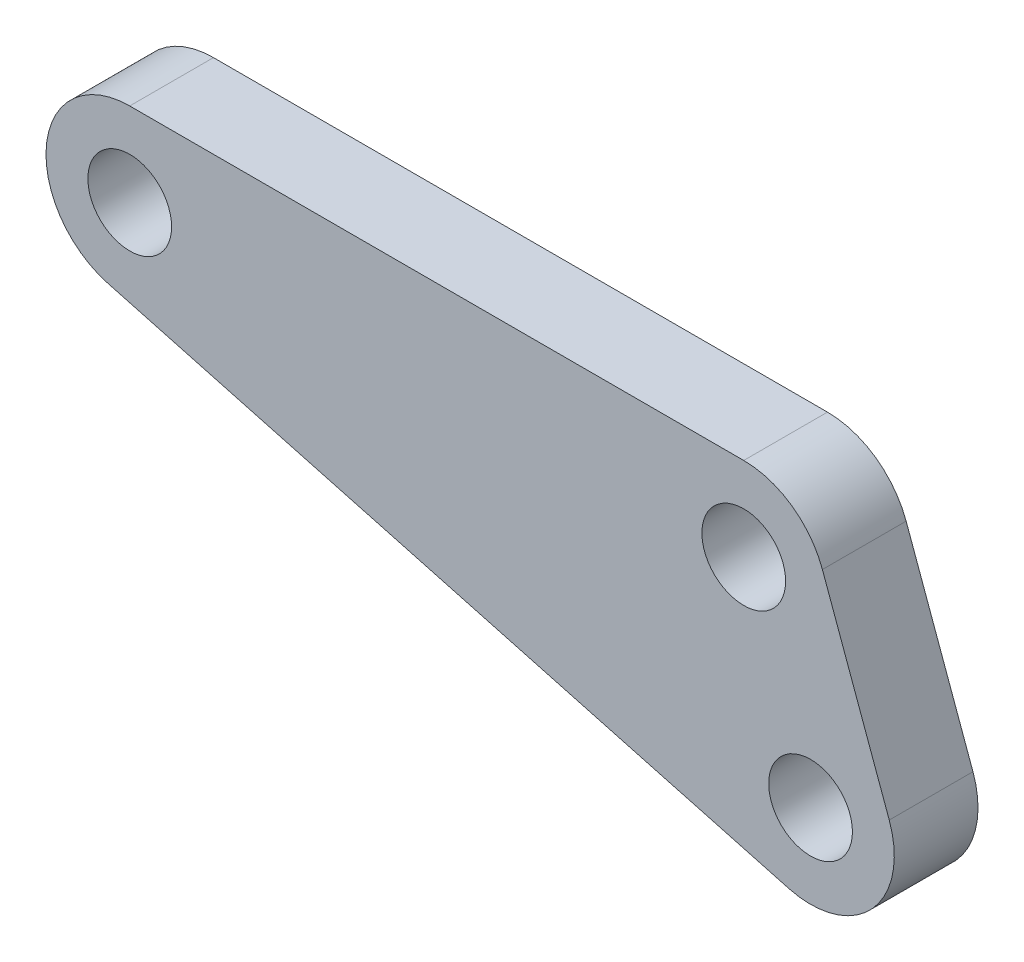
from build123d import *

# Parameters (mm, degrees)
SKETCH2_R           = 1.5
BOSS_EXTRUDE1_DEPTH = 3


with BuildPart() as part:
    # Sketch2 → Boss-Extrude1 (new body)
    with BuildSketch(Plane.XY):
        with BuildLine():
            Line((-22, 3), (0, 3))
            ThreePointArc((0, 3), (1.720729309, 2.457456133), (2.819077862, 1.02606043))
            Line((2.819077862, 1.02606043), (5.213218866, -5.551787916))
            ThreePointArc((5.213218866, -5.551787916), (4.604366119, -8.606371192), (1.613091911, -9.474391512))
            Line((1.613091911, -9.474391512), (-22.781049092, -2.896543167))
            ThreePointArc((-22.781049092, -2.896543167), (-24.974023327, 0.393935591), (-22, 3))
        make_face()
        with Locations((-22, 0)):
            Circle(SKETCH2_R, mode=Mode.SUBTRACT)
        Circle(SKETCH2_R, mode=Mode.SUBTRACT)
        with Locations((2.394141003, -6.577848346)):
            Circle(SKETCH2_R, mode=Mode.SUBTRACT)
    extrude(amount=BOSS_EXTRUDE1_DEPTH)


solid = part.part
